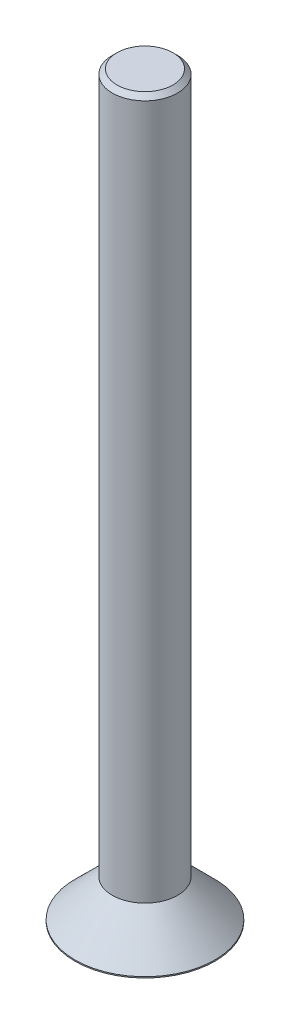
from build123d import *

# Parameters (mm, degrees)
SKETCH_1_R          = 3
EXTRUDE_1_DEPTH     = 1.65
CHAMFER_1_SIZE      = 1.6
CUT_EXTRUDE_1_DEPTH = 0.95
SKETCH_3_R          = 1.4
EXTRUDE_2_DEPTH     = 30
CHAMFER_2_SIZE      = 0.2


with BuildPart() as part:
    # 草图1 → 凸台-拉伸1 (new body)
    with BuildSketch(Plane(origin=(0, 0, 0), x_dir=(1, 0, 0), z_dir=(0, 1, 0))):
        with Locations(Location((0, 0, 0), (0, 0, 270))):
            Circle(SKETCH_1_R)
    extrude(amount=EXTRUDE_1_DEPTH)

    # 倒角1
    chamfer_1_edges = [part.edges().sort_by_distance(p)[0] for p in [
        (0, 1.65, -3),
    ]]
    chamfer(chamfer_1_edges, length=CHAMFER_1_SIZE)

    # 草图2 → 切除-拉伸1 (cut)
    with BuildSketch(Plane.XZ):
        Polygon((1, -0.577350269), (1, 0.577350269), (0, 1.154700538), (-1, 0.577350269), (-1, -0.577350269), (0, -1.154700538), align=None)
    extrude(amount=-CUT_EXTRUDE_1_DEPTH, mode=Mode.SUBTRACT)

    # 草图3 → 凸台-拉伸2 (add)
    with BuildSketch(Plane(origin=(0, 1.65, 0), x_dir=(1, 0, 0), z_dir=(0, 1, 0))):
        with Locations(Location((0, 0, 0), (0, 0, 270))):
            Circle(SKETCH_3_R)
    extrude(amount=EXTRUDE_2_DEPTH)

    # 倒角2
    chamfer_2_edges = [part.edges().sort_by_distance(p)[0] for p in [
        (0, 31.65, -1.4),
    ]]
    chamfer(chamfer_2_edges, length=CHAMFER_2_SIZE)


solid = part.part
